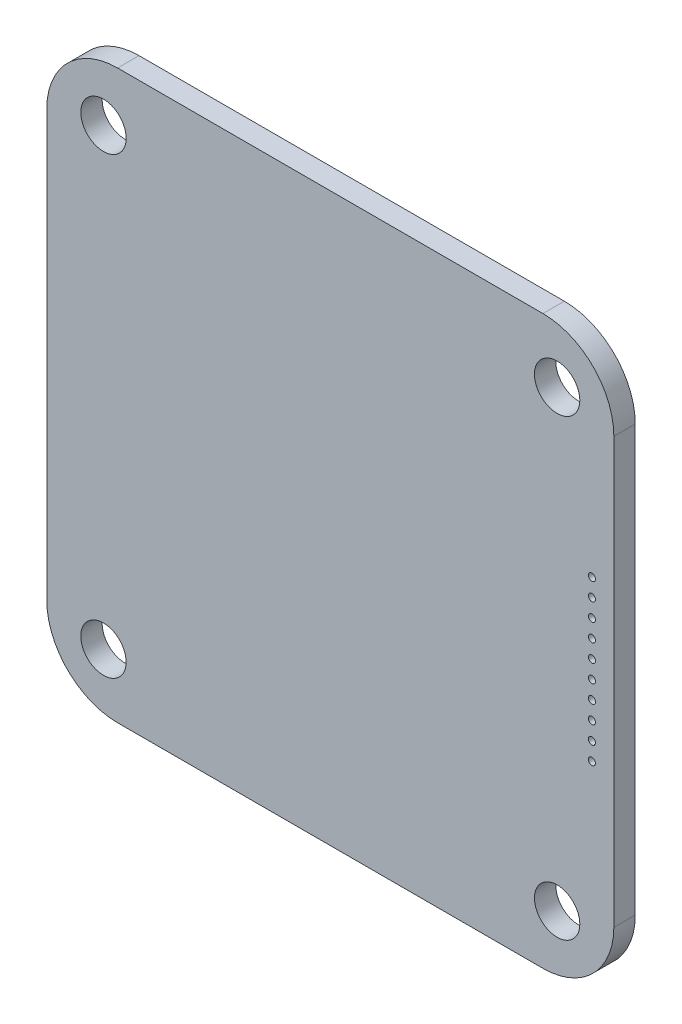
from build123d import *

# Parameters (mm, degrees)
SKETCH19_R          = 1.6
SKETCH19_R_2        = 0.25
BOSS_EXTRUDE4_DEPTH = 1.51


with BuildPart() as part:
    # Sketch19 → Boss-Extrude4 (new body)
    with BuildSketch(Plane.XY.offset(8.099998999)):
        with BuildLine():
            Line((41.85, -76.85), (71.85, -76.85))
            ThreePointArc((71.85, -76.85), (75.385534, -75.385534), (76.85, -71.85))
            Line((76.85, -71.85), (76.85, -41.85))
            ThreePointArc((76.85, -41.85), (75.385534, -38.314466), (71.85, -36.85))
            Line((71.85, -36.85), (41.85, -36.85))
            ThreePointArc((41.85, -36.85), (38.314466, -38.314466), (36.85, -41.85))
            Line((36.85, -41.85), (36.85, -71.85))
            ThreePointArc((36.85, -71.85), (38.314466, -75.385534), (41.85, -76.85))
        make_face()
        with Locations((40.85, -72.85)):
            Circle(SKETCH19_R, mode=Mode.SUBTRACT)
        with Locations((72.85, -72.85)):
            Circle(SKETCH19_R, mode=Mode.SUBTRACT)
        with Locations((75.305, -62.475)):
            Circle(SKETCH19_R_2, mode=Mode.SUBTRACT)
        with Locations((75.305, -61.225001)):
            Circle(SKETCH19_R_2, mode=Mode.SUBTRACT)
        with Locations((75.305, -59.975)):
            Circle(SKETCH19_R_2, mode=Mode.SUBTRACT)
        with Locations((75.305, -58.725001)):
            Circle(SKETCH19_R_2, mode=Mode.SUBTRACT)
        with Locations((75.305, -57.475)):
            Circle(SKETCH19_R_2, mode=Mode.SUBTRACT)
        with Locations((40.85, -40.85)):
            Circle(SKETCH19_R, mode=Mode.SUBTRACT)
        with Locations((75.305, -56.225001)):
            Circle(SKETCH19_R_2, mode=Mode.SUBTRACT)
        with Locations((75.305, -54.975)):
            Circle(SKETCH19_R_2, mode=Mode.SUBTRACT)
        with Locations((75.305, -53.725)):
            Circle(SKETCH19_R_2, mode=Mode.SUBTRACT)
        with Locations((75.305, -52.475)):
            Circle(SKETCH19_R_2, mode=Mode.SUBTRACT)
        with Locations((75.305, -51.225)):
            Circle(SKETCH19_R_2, mode=Mode.SUBTRACT)
        with Locations((72.85, -40.85)):
            Circle(SKETCH19_R, mode=Mode.SUBTRACT)
    extrude(amount=-BOSS_EXTRUDE4_DEPTH)


solid = part.part
